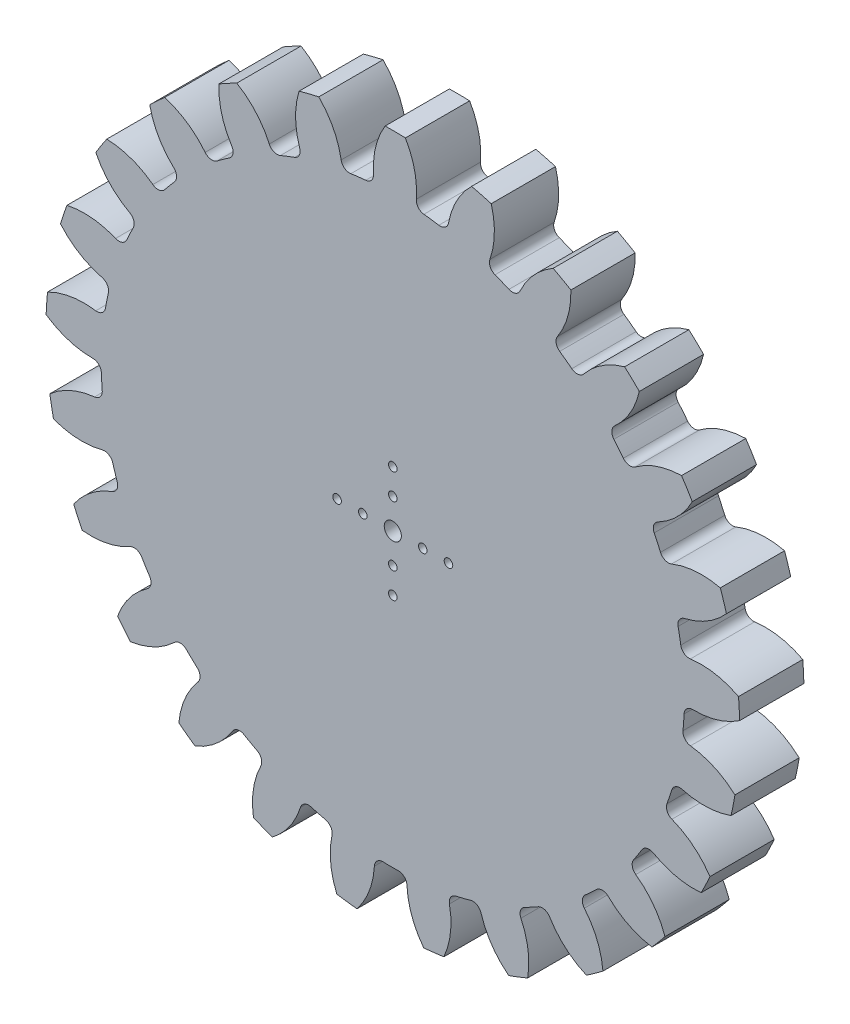
from build123d import *

# Parameters (mm, degrees)
SKETCH12_R               = 68.058
BOSS_EXTRUDE2_DEPTH      = 7.5
BOSS_EXTRUDE3_DEPTH      = 7.5
FILLET1_R                = 2
CIRPATTERN2_COUNT        = 25
FILLET1_OF_CIRPATTERN2_R = 2
CROQUIS1_R               = 1
CORTAR_EXTRUIR1_DEPTH    = 15
CROQUIS2_R               = 2
CORTAR_EXTRUIR2_DEPTH    = 15
SKETCH14_R               = 1
CUT_EXTRUDE1_DEPTH       = 15


with BuildPart() as part:
    # Sketch12 → Boss-Extrude2 (new, symmetric)
    with BuildSketch(Plane.XY):
        Circle(SKETCH12_R)
    extrude(amount=BOSS_EXTRUDE2_DEPTH, both=True)

    # Sketch13 → Boss-Extrude3 (add, symmetric)
    with BuildSketch(Plane.XY):
        with BuildLine():
            ThreePointArc((-28.125648846, 61.974504766), (-32.366218452, 59.869184621), (-36.450160371, 57.474143516))
            ThreePointArc((-36.450160371, 57.474143516), (-39.675483485, 63.406008385), (-40.590482306, 70.095739857))
            ThreePointArc((-40.590482306, 70.095739857), (-38.521021696, 71.253988573), (-36.418540173, 72.351157086))
            ThreePointArc((-36.418540173, 72.351157086), (-31.322395625, 67.921818449), (-28.125648846, 61.974504766))
        make_face()
    boss_extrude3 = extrude(amount=BOSS_EXTRUDE3_DEPTH, both=True)

    # Fillet1
    fillet1_edges = [part.edges().sort_by_distance(p)[0] for p in [
        (-28.125648846, 61.974504766, 0),
        (-36.450160371, 57.474143516, 0),
    ]]
    fillet(fillet1_edges, radius=FILLET1_R)

    # CirPattern2: Boss-Extrude3 ×25 about axis
    cirpattern2_axis = Axis((0, 0, 0), (0, 0, 1))
    for i in range(1, CIRPATTERN2_COUNT):
        add(boss_extrude3.rotate(cirpattern2_axis, i * 360 / CIRPATTERN2_COUNT))

    # Fillet1 of CirPattern2
    fillet1_of_cirpattern2_edges = [part.edges().sort_by_distance(p)[0] for p in [
        (-42.654462466, 53.032897297, 0),
        (-49.598249822, 46.60370134, 0),
        (-54.503139336, 40.75903785, 0),
        (-59.629898827, 32.804977213, 0),
        (-62.927183514, 25.924138154, 0),
        (-65.914781985, 16.944995719, 0),
        (-67.397281321, 9.460329515, 0),
        (-68.057996973, 0.020297824, 0),
        (-67.632560073, -7.59790642, 0),
        (-65.924877712, -16.905675457, 0),
        (-63.618236341, -24.178737951, 0),
        (-59.649455929, -32.769402975, 0),
        (-55.606544847, -39.240330454, 0),
        (-49.626039455, -46.574108386, 0),
        (-44.100889635, -51.836308679, 0),
        (-36.484436411, -57.45239128, 0),
        (-29.824213335, -61.175220988, 0),
        (-21.050382046, -64.720729135, 0),
        (-13.673572025, -66.670269177, 0),
        (-4.293654759, -67.922425552, 0),
        (3.336230103, -67.976179156, 0),
        (12.732858647, -66.85630617, 0),
        (20.136404624, -65.010895801, 0),
        (28.959319716, -61.589359191, 0),
        (35.671334785, -57.960738769, 0),
        (43.366160223, -52.452526265, 0),
        (48.964903793, -47.268695355, 0),
        (55.048145393, -40.019908206, 0),
        (59.181827814, -33.60658597, 0),
        (63.271253135, -25.072692132, 0),
        (65.680139938, -17.832851193, 0),
        (67.518795347, -8.5500666, 0),
        (68.051527316, -0.93861279, 0),
        (67.523883331, 8.509791061, 0),
        (66.146986956, 16.014602106, 0),
        (63.28619739, 25.034947253, 0),
        (60.086188134, 31.961560655, 0),
        (55.072006916, 39.987065637, 0),
        (50.24995313, 45.900256801, 0),
        (43.397439707, 52.426649624, 0),
        (37.256328765, 56.954871003, 0),
        (28.996051757, 61.572074405, 0),
        (21.921752244, 64.430801194, 0),
        (12.772735235, 66.848699304, 0),
        (5.209751407, 67.858307187, 0),
        (-4.253139217, 67.924974573, 0),
        (-11.829597271, 67.022026174, 0),
        (-21.01177329, 64.73327388, 0),
    ]]
    fillet(fillet1_of_cirpattern2_edges, radius=FILLET1_OF_CIRPATTERN2_R)

    # Croquis1 → Cortar-Extruir1 (cut)
    with BuildSketch(Plane(origin=(0, 0, -7.5), x_dir=(-1, 0, 0), z_dir=(0, 0, -1))):
        with Locations((7, 0)):
            Circle(CROQUIS1_R)
        with Locations((13, 0)):
            Circle(CROQUIS1_R)
        with Locations((-7, 0)):
            Circle(CROQUIS1_R)
        with Locations((-13, 0)):
            Circle(CROQUIS1_R)
    extrude(amount=-CORTAR_EXTRUIR1_DEPTH, mode=Mode.SUBTRACT)

    # Croquis2 → Cortar-Extruir2 (cut)
    with BuildSketch(Plane(origin=(0, 0, -7.5), x_dir=(-1, 0, 0), z_dir=(0, 0, -1))):
        Circle(CROQUIS2_R)
    extrude(amount=-CORTAR_EXTRUIR2_DEPTH, mode=Mode.SUBTRACT)

    # Sketch14 → Cut-Extrude1 (cut)
    with BuildSketch(Plane(origin=(0, 0, -7.5), x_dir=(-1, 0, 0), z_dir=(0, 0, -1))):
        with Locations((0, 7)):
            Circle(SKETCH14_R)
        with Locations((0, 13)):
            Circle(SKETCH14_R)
        with Locations((0, -7)):
            Circle(SKETCH14_R)
        with Locations((0, -13)):
            Circle(SKETCH14_R)
    extrude(amount=-CUT_EXTRUDE1_DEPTH, mode=Mode.SUBTRACT)


solid = part.part
